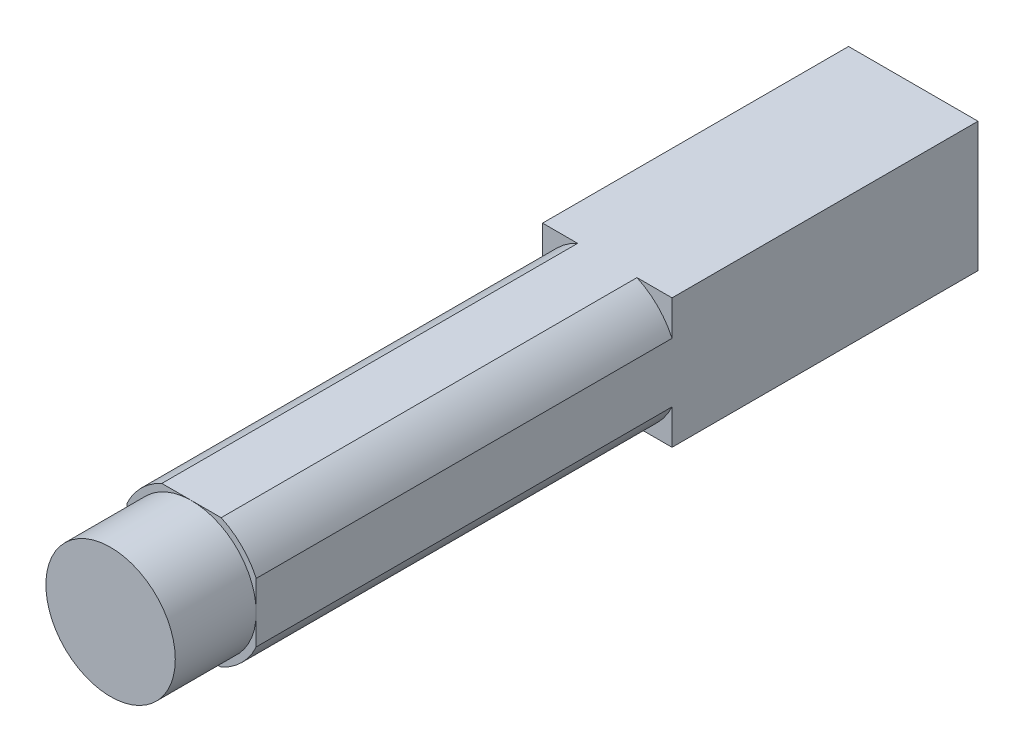
from build123d import *

# Parameters (mm, degrees)
SKETCH1_W           = 6.35
SKETCH1_H           = 6.35
BOSS_EXTRUDE1_DEPTH = 39.37
SKETCH2_W           = 6.35
SKETCH2_H           = 6.35
SKETCH2_R           = 3.17373
CUT_EXTRUDE1_DEPTH  = 3.96875
SKETCH3_W           = 9.525
SKETCH3_H           = 9.525
SKETCH3_R           = 3.4925
CUT_EXTRUDE2_DEPTH  = 20.394676


with BuildPart() as part:
    # Sketch1 → Boss-Extrude1 (new body)
    with BuildSketch(Plane.XY):
        Rectangle(SKETCH1_W, SKETCH1_H)
    extrude(amount=BOSS_EXTRUDE1_DEPTH)

    # Sketch2 → Cut-Extrude1 (cut)
    with BuildSketch(Plane.XY.offset(39.37)):
        Rectangle(SKETCH2_W, SKETCH2_H)
        Circle(SKETCH2_R, mode=Mode.SUBTRACT)
    extrude(amount=-CUT_EXTRUDE1_DEPTH, mode=Mode.SUBTRACT)

    # Sketch3 → Cut-Extrude2 (cut)
    with BuildSketch(Plane.XY.offset(35.40125)):
        Rectangle(SKETCH3_W, SKETCH3_H)
        Circle(SKETCH3_R, mode=Mode.SUBTRACT)
    extrude(amount=-CUT_EXTRUDE2_DEPTH, mode=Mode.SUBTRACT)


solid = part.part
